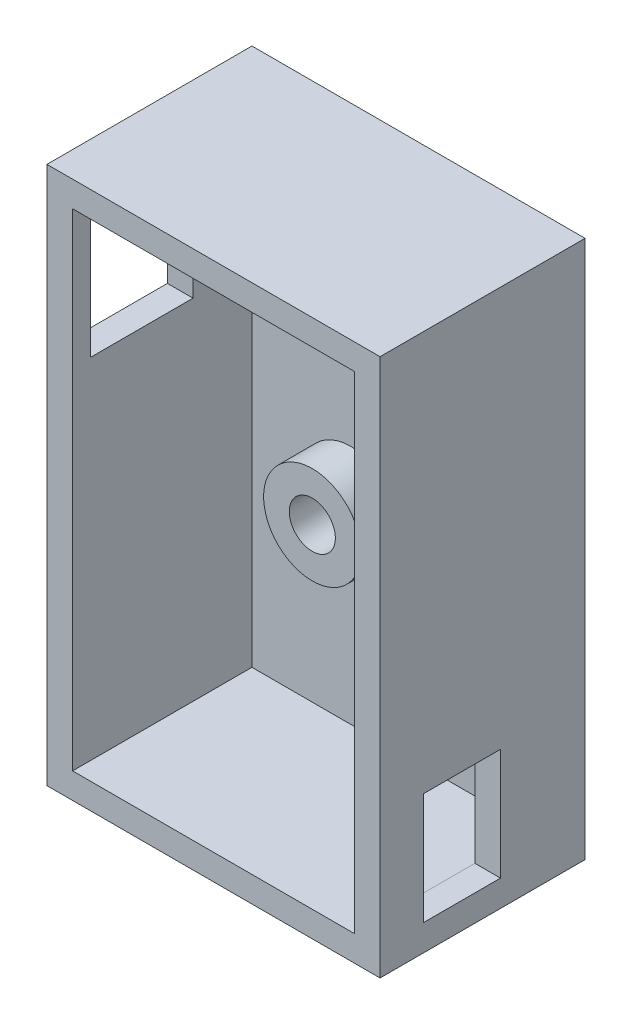
from build123d import *

# Parameters (mm, degrees)
SKETCH1_W           = 26
SKETCH1_H           = 42
BOSS_EXTRUDE1_DEPTH = 16
SHELL1_T            = -2
SKETCH2_R           = 3.8
SKETCH2_R_2         = 1.8
BOSS_EXTRUDE2_DEPTH = 3
CUT_EXTRUDE2_START  = -2
SKETCH2_2_R         = 1.8
CUT_EXTRUDE2_DEPTH  = 2
SKETCH4_W           = 8
SKETCH4_H           = 10.725495138
CUT_EXTRUDE3_DEPTH  = 2
SKETCH5_W           = 6
SKETCH5_H           = 8.708980209
CUT_EXTRUDE4_DEPTH  = 2


with BuildPart() as part:
    # Sketch1 → Boss-Extrude1 (new body)
    with BuildSketch(Plane.XY):
        Rectangle(SKETCH1_W, SKETCH1_H)
    extrude(amount=BOSS_EXTRUDE1_DEPTH)

    # Shell1
    shell1_openings = [part.faces().sort_by_distance(p)[0] for p in [
        (0, 0, 16),
    ]]
    offset(amount=SHELL1_T, openings=shell1_openings, kind=Kind.INTERSECTION)

    # Sketch2 → Boss-Extrude2 (add)
    # profile 1 of 2: a face of its own
    with BuildSketch(Plane.XY.offset(2)):
        with Locations((-3.288169065, -4.006418736)):
            Circle(SKETCH2_R)
        with Locations((-3.288169065, -4.006418736)):
            Circle(SKETCH2_R_2, mode=Mode.SUBTRACT)
    # profile 2 of 2: a face of its own
    with BuildSketch(Plane.XY.offset(2)):
        with Locations((6.486240627, 13.735356113)):
            Circle(SKETCH2_R)
        with Locations((6.486240627, 13.735356113)):
            Circle(SKETCH2_R_2, mode=Mode.SUBTRACT)
    extrude(amount=BOSS_EXTRUDE2_DEPTH)

    # Sketch2<2> → Cut-Extrude2 (cut)
    with BuildSketch(Plane.XY.offset(2).offset(CUT_EXTRUDE2_START)):
        with Locations((6.486240627, 13.735356113)):
            Circle(SKETCH2_2_R)
        with Locations((-3.288169065, -4.006418736)):
            Circle(SKETCH2_2_R)
    extrude(amount=CUT_EXTRUDE2_DEPTH, mode=Mode.SUBTRACT)

    # Sketch4 → Cut-Extrude3 (cut)
    with BuildSketch(Plane.ZY.offset(13)):
        with Locations((10.6, 13.616095809)):
            Rectangle(SKETCH4_W, SKETCH4_H)
    extrude(amount=-CUT_EXTRUDE3_DEPTH, mode=Mode.SUBTRACT)

    # Sketch5 → Cut-Extrude4 (cut)
    with BuildSketch(Plane(origin=(13, 0, 0), x_dir=(0, 0, -1), z_dir=(1, 0, 0))):
        with Locations((-9.6, -14.594189668)):
            Rectangle(SKETCH5_W, SKETCH5_H)
    extrude(amount=-CUT_EXTRUDE4_DEPTH, mode=Mode.SUBTRACT)


solid = part.part
